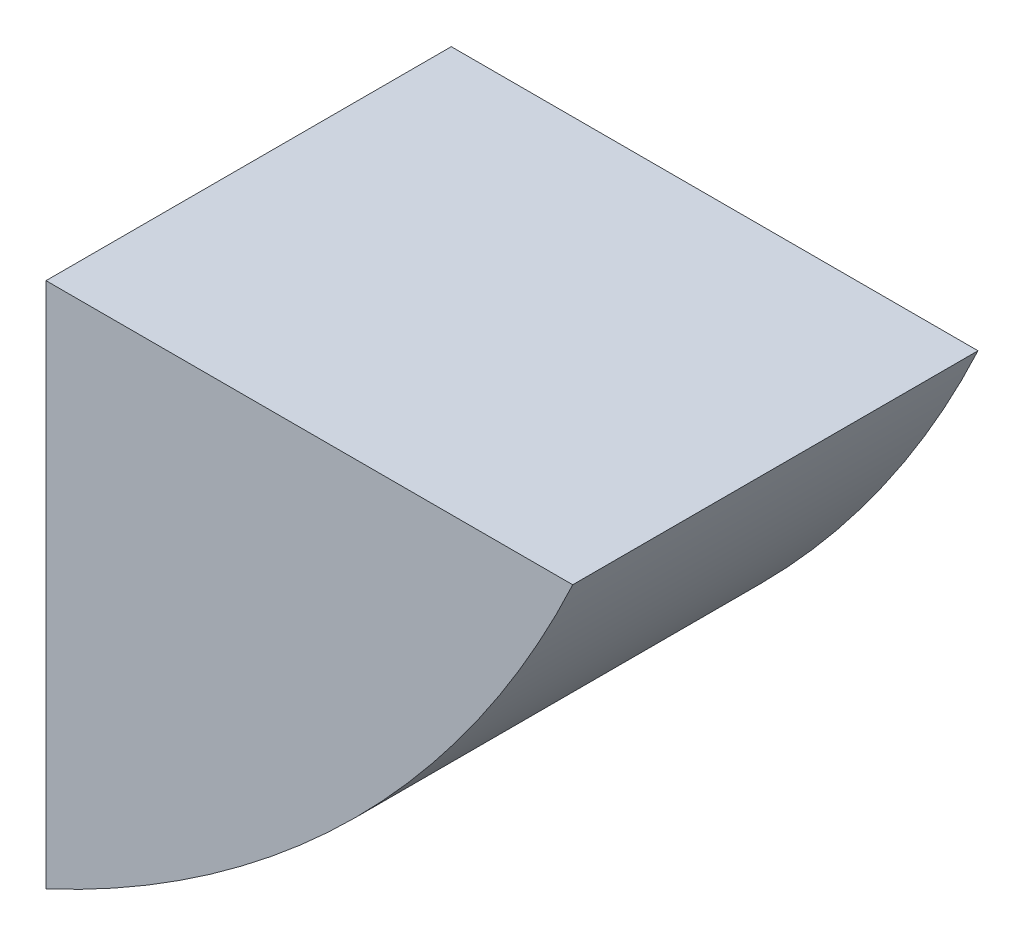
from build123d import *

# Parameters (mm, degrees)
BOSS_EXTRUDE1_DEPTH = 9.525


with BuildPart() as part:
    # Sketch1 → Boss-Extrude1 (new, symmetric)
    with BuildSketch(Plane.XY):
        with BuildLine():
            Line((21.59, -21.59), (46.34834681, -21.59))
            ThreePointArc((46.34834681, -21.59), (36.154511143, -36.154511143), (21.59, -46.34834681))
            Line((21.59, -46.34834681), (21.59, -21.59))
        make_face()
    extrude(amount=BOSS_EXTRUDE1_DEPTH, both=True)


solid = part.part
